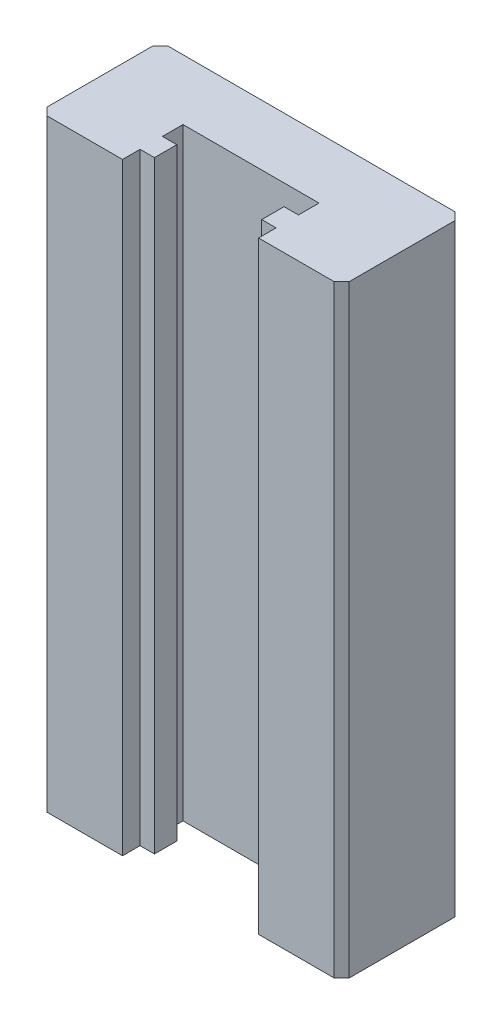
from build123d import *

# Parameters (mm, degrees)
EXTRUDE_1_DEPTH     = 39.9
SKETCH_2_R          = 1.5
CUT_EXTRUDE_1_DEPTH = 3
CHAMFER_1_SIZE      = 0.5


with BuildPart() as part:
    # 草图1 → 凸台-拉伸1 (new body)
    with BuildSketch(Plane(origin=(0, 0, 0), x_dir=(1, 0, 0), z_dir=(0, 1, 0))):
        Polygon((-10, 4), (-10, -4), (-4.5, -4), (-4.5, -2.84), (-3.55, -2.84), (-3.55, -1.36), (-4.5, -1.36), (-4.5, 0), (4.5, 0), (4.5, -1.36), (3.55, -1.36), (3.55, -2.84), (4.5, -2.84), (4.5, -4), (10, -4), (10, 4), align=None)
    extrude(amount=EXTRUDE_1_DEPTH)

    # 草图2 → 切除-拉伸1 (cut)
    with BuildSketch(Plane(origin=(0, 0, -4), x_dir=(-1, 0, 0), z_dir=(0, 0, -1))):
        with Locations((7.5, 27.95)):
            Circle(SKETCH_2_R)
        with Locations(Location((-7.5, 27.95, 0), (0, 0, 180))):
            Circle(SKETCH_2_R)
        with Locations(Location((7.5, 11.95, 0), (0, 0, 180))):
            Circle(SKETCH_2_R)
        with Locations((-7.5, 11.95)):
            Circle(SKETCH_2_R)
    extrude(amount=-CUT_EXTRUDE_1_DEPTH, mode=Mode.SUBTRACT)

    # 倒角1
    chamfer_1_edges = [part.edges().sort_by_distance(p)[0] for p in [
        (-10, 19.95, 4),
        (-10, 19.95, -4),
        (10, 19.95, -4),
        (10, 19.95, 4),
    ]]
    chamfer(chamfer_1_edges, length=CHAMFER_1_SIZE)


solid = part.part
